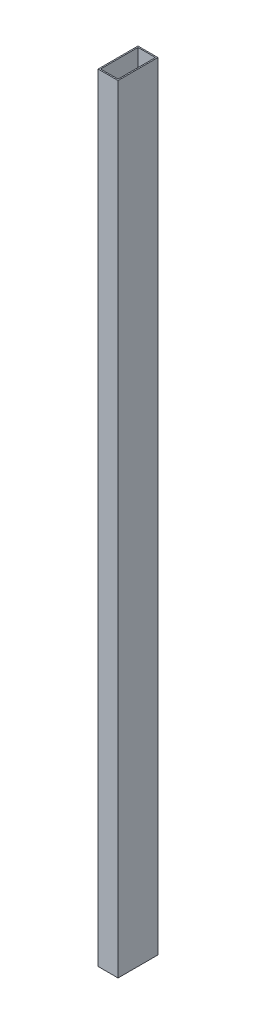
from build123d import *

# Parameters (mm, degrees)
SKETCH2_W           = 25.4
SKETCH2_H           = 50.8
SKETCH2_W_2         = 22.352
SKETCH2_H_2         = 47.752
EXTRUDE_THIN1_DEPTH = 990.6


with BuildPart() as part:
    # Sketch2 → Extrude-Thin1 (new body)
    with BuildSketch(Plane(origin=(0, 0, 0), x_dir=(1, 0, 0), z_dir=(0, 1, 0))):
        with Locations((12.7, 25.4)):
            Rectangle(SKETCH2_W, SKETCH2_H)
        with Locations((12.7, 25.4)):
            Rectangle(SKETCH2_W_2, SKETCH2_H_2, mode=Mode.SUBTRACT)
    extrude(amount=EXTRUDE_THIN1_DEPTH)


solid = part.part
